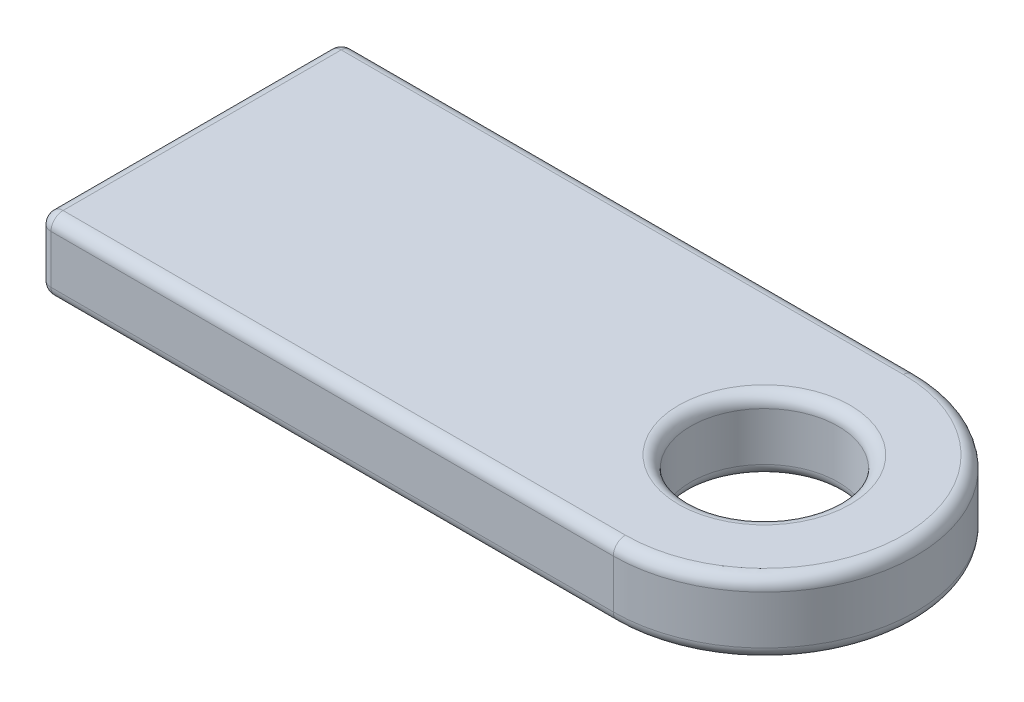
from build123d import *

# Parameters (mm, degrees)
SKETCH_1_R      = 3.05
EXTRUDE_1_DEPTH = 3
FILLET_1_R      = 0.5


with BuildPart() as part:
    # 草图1 → 凸台-拉伸1 (new body)
    with BuildSketch(Plane(origin=(0, 0, 0), x_dir=(1, 0, 0), z_dir=(0, 1, 0))):
        with BuildLine():
            Line((0, 0), (23.75, 0))
            ThreePointArc((23.75, 0), (30, 6.25), (23.75, 12.5))
            Line((23.75, 12.5), (0, 12.5))
            Line((0, 12.5), (0, 0))
        make_face()
        with Locations(Location((23.75, 6.25, 0), (0, 0, 270))):
            Circle(SKETCH_1_R, mode=Mode.SUBTRACT)
    extrude(amount=EXTRUDE_1_DEPTH)

    # 圆角1
    fillet_1_edges = [part.edges().sort_by_distance(p)[0] for p in [
        (23.75, 0, -9.3),
        (23.75, 3, -9.3),
        (30, 3, -6.25),
        (11.875, 3, -12.5),
        (0, 3, -6.25),
        (11.875, 0, -12.5),
        (30, 0, -6.25),
        (11.875, 0, 0),
        (0, 0, -6.25),
        (0, 1.5, -12.5),
        (0, 1.5, 0),
        (11.875, 3, 0),
    ]]
    fillet(fillet_1_edges, radius=FILLET_1_R)


solid = part.part
